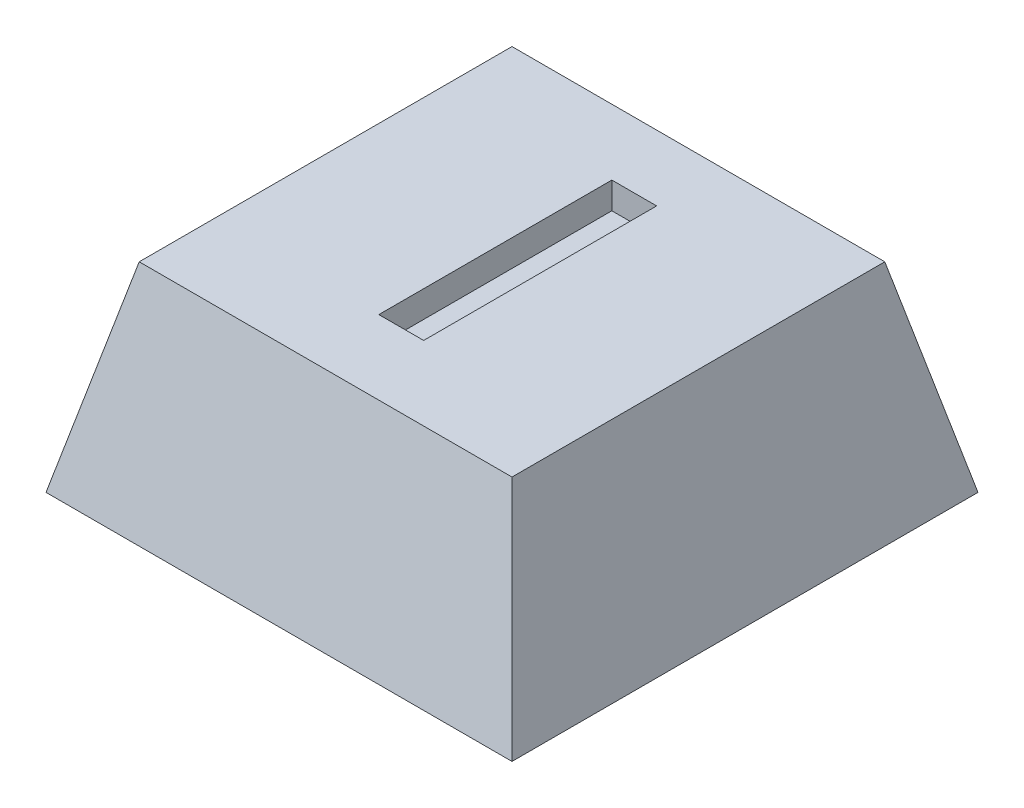
from build123d import *

# Parameters (mm, degrees)
SKETCH1_W           = 7
SKETCH1_H           = 7
BOSS_EXTRUDE1_DEPTH = 3
CUT_EXTRUDE1_DEPTH  = 7
CUT_EXTRUDE2_DEPTH  = 11
SKETCH4_R           = 1.8
CUT_EXTRUDE3_DEPTH  = 0.8
SKETCH5_W           = 0.673076923
SKETCH5_H           = 3.5
CUT_EXTRUDE4_DEPTH  = 0.4


with BuildPart() as part:
    # Sketch1 → Boss-Extrude1 (new body)
    with BuildSketch(Plane(origin=(0, 0, 0), x_dir=(1, 0, 0), z_dir=(0, 1, 0))):
        with Locations((3.5, 3.5)):
            Rectangle(SKETCH1_W, SKETCH1_H)
    extrude(amount=BOSS_EXTRUDE1_DEPTH)

    # Sketch2 → Cut-Extrude1 (cut)
    with BuildSketch(Plane.XY):
        Polygon((0, 0), (0.7, 3), (0, 3), align=None)
        Polygon((7, 0), (6.3, 3), (7, 3), align=None)
    extrude(amount=-CUT_EXTRUDE1_DEPTH, mode=Mode.SUBTRACT)

    # Sketch3 → Cut-Extrude2 (cut)
    with BuildSketch(Plane(origin=(0, 0, 0), x_dir=(0, 0, -1), z_dir=(1, 0, 0))):
        Polygon((0, 0), (0.7, 3), (0, 3), align=None)
        Polygon((7, 3), (6.3, 3), (7, 0), align=None)
    extrude(amount=CUT_EXTRUDE2_DEPTH, mode=Mode.SUBTRACT)

    # Sketch4 → Cut-Extrude3 (cut)
    with BuildSketch(Plane.XZ):
        with Locations(Location((3.5, -3.5, 0), (0, 0, 270))):
            Circle(SKETCH4_R)
    extrude(amount=-CUT_EXTRUDE3_DEPTH, mode=Mode.SUBTRACT)

    # Sketch5 → Cut-Extrude4 (cut)
    with BuildSketch(Plane(origin=(0, 3, 0), x_dir=(1, 0, 0), z_dir=(0, 1, 0))):
        with Locations((3.523173037, 3.563258093)):
            Rectangle(SKETCH5_W, SKETCH5_H)
    extrude(amount=-CUT_EXTRUDE4_DEPTH, mode=Mode.SUBTRACT)


solid = part.part
